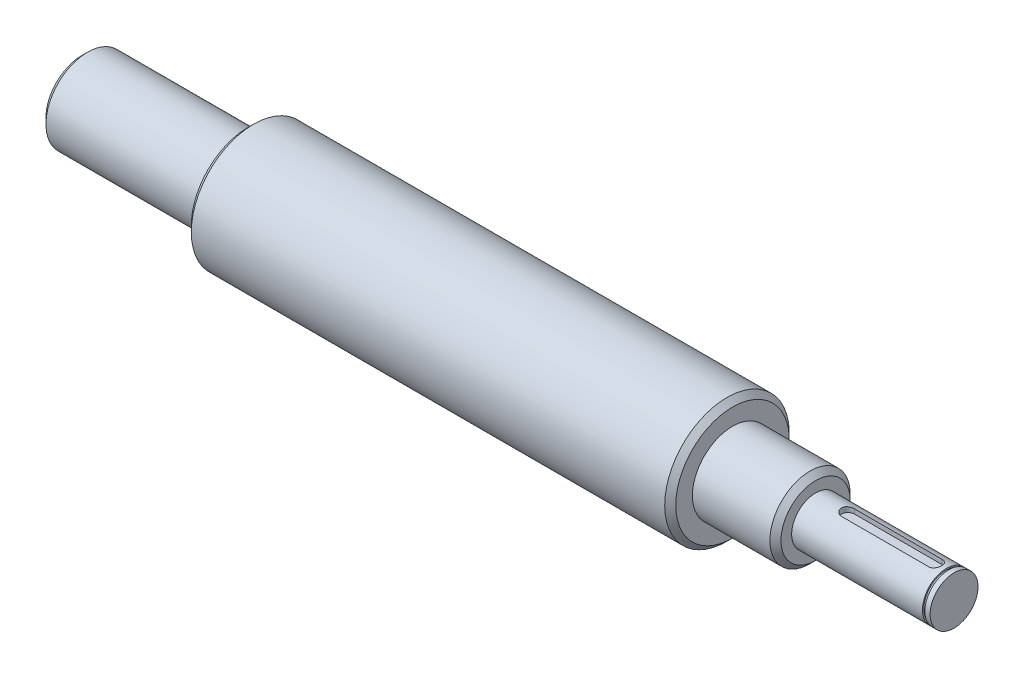
from build123d import *

# Parameters (mm, degrees)
CHAMFER1_SIZE      = 2.54
CHAMFER2_SIZE      = 2.54
FILLET1_R          = 2.54
CUT_EXTRUDE2_DEPTH = 2.5
SKETCH7_R          = 11
SKETCH7_R_2        = 10.35
CUT_EXTRUDE3_DEPTH = 1.1


with BuildPart() as part:
    # Sketch1 → Revolve1 (revolve)
    with BuildSketch(Plane.XY, mode=Mode.PRIVATE) as revolve1_sk:
        Polygon((-200, 0), (200, 0), (200, 11), (136.5, 11), (136.5, 18.415), (98.4, 18.415), (98.4, 28.575), (-123.8, 28.575), (-123.8, 19.05), (-200, 19.05), align=None)
    revolve(revolve1_sk.sketch.rotate(Axis((-1910.961105754, 0, 0), (1, 0, 0)), 90), axis=Axis((-1910.961105754, 0, 0), (1, 0, 0)))

    # Chamfer1
    chamfer1_edges = [part.edges().sort_by_distance(p)[0] for p in [
        (136.5, 0, -18.415),
        (98.4, 0, -28.575),
    ]]
    chamfer(chamfer1_edges, length=CHAMFER1_SIZE)

    # Chamfer2
    chamfer2_edges = [part.edges().sort_by_distance(p)[0] for p in [
        (-123.8, 0, -28.575),
        (-200, 0, -19.05),
    ]]
    chamfer(chamfer2_edges, length=CHAMFER2_SIZE)

    # Fillet1
    fillet1_edges = [part.edges().sort_by_distance(p)[0] for p in [
        (-123.8, 0, -19.05),
    ]]
    fillet(fillet1_edges, radius=FILLET1_R)

    # Sketch3 → Cut-Extrude2 (cut)
    with BuildSketch(Plane(origin=(0, 11, 0), x_dir=(1, 0, 0), z_dir=(0, 1, 0))):
        with BuildLine():
            Line((151.375, 3), (191.375, 3))
            ThreePointArc((191.375, 3), (194.375, 0), (191.375, -3))
            Line((191.375, -3), (151.375, -3))
            ThreePointArc((151.375, -3), (148.375, 0), (151.375, 3))
        make_face()
    extrude(amount=-CUT_EXTRUDE2_DEPTH, mode=Mode.SUBTRACT)

    # Sketch7 → Cut-Extrude3 (cut)
    with BuildSketch(Plane(origin=(196.49768, 0, 0), x_dir=(0, 0, -1), z_dir=(1, 0, 0))):
        with Locations(Location((0, 0, 0), (0, 0, 180))):
            Circle(SKETCH7_R)
        Circle(SKETCH7_R_2, mode=Mode.SUBTRACT)
    extrude(amount=CUT_EXTRUDE3_DEPTH, mode=Mode.SUBTRACT)


solid = part.part
